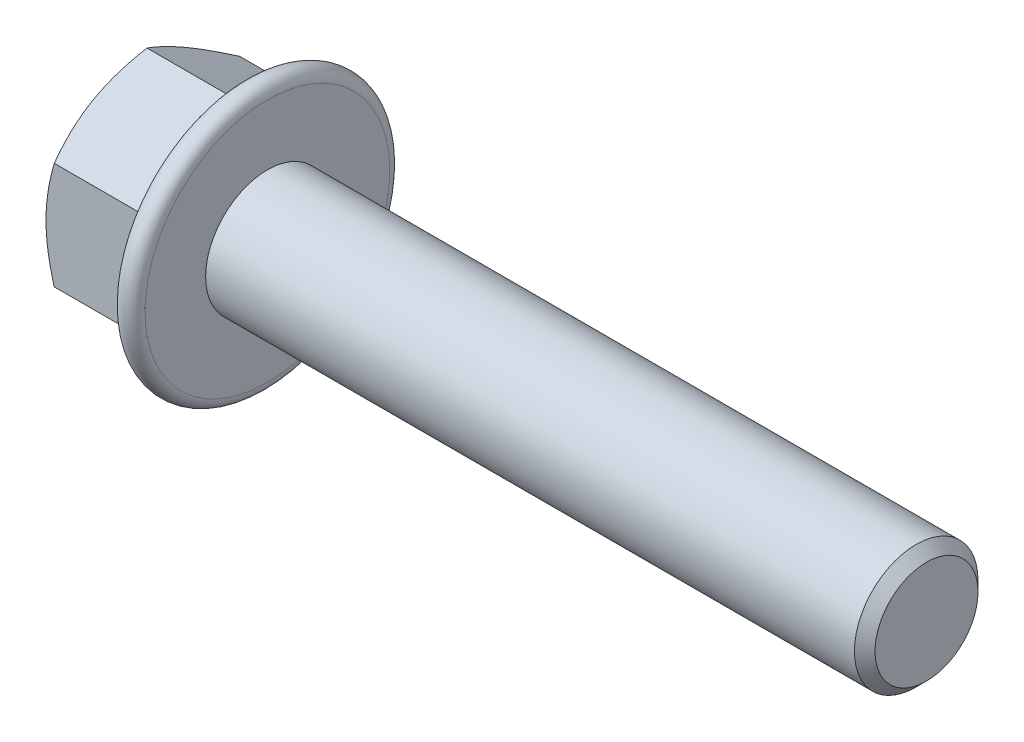
from build123d import *

# Parameters (mm, degrees)
SKETCH2_R           = 4.7625
BOSS_EXTRUDE1_DEPTH = 50.8
CHAMFER1_SIZE       = 0.793750063
BOSS_EXTRUDE2_DEPTH = 9.921875
SKETCH5_OUTSIDE_W   = 70.482
SKETCH5_OUTSIDE_H   = 70.482
SKETCH5_OUTSIDE_R   = 7.14375
CUT_EXTRUDE1_DEPTH  = 9.921875
CUT_EXTRUDE1_DRAFT  = -60
SKETCH6_R           = 6.429375
CUT_EXTRUDE2_DEPTH  = 0.826822917
CUT_EXTRUDE2_DRAFT  = -35
SKETCH14_W          = 25.4
SKETCH14_H          = 4.7625


with BuildPart() as part:
    # Sketch2 → Boss-Extrude1 (new body)
    with BuildSketch(Plane(origin=(0, 0, 0), x_dir=(0, 0, -1), z_dir=(1, 0, 0))):
        Circle(SKETCH2_R)
    extrude(amount=BOSS_EXTRUDE1_DEPTH)

    # Chamfer1
    chamfer1_edges = [part.edges().sort_by_distance(p)[0] for p in [
        (50.8, 0, 4.7625),
    ]]
    chamfer(chamfer1_edges, length=CHAMFER1_SIZE)

    # Sketch3 → Boss-Extrude2 (add)
    with BuildSketch(Plane.ZY):
        Polygon((0, 8.248891971), (-7.14375, 4.124445986), (-7.14375, -4.124445986), (0, -8.248891971), (7.14375, -4.124445986), (7.14375, 4.124445986), align=None)
    extrude(amount=BOSS_EXTRUDE2_DEPTH)

    # Sketch4 → Revolve1 (revolve)
    with BuildSketch(Plane.XY, mode=Mode.PRIVATE) as revolve1_sk:
        with BuildLine():
            Line((0, 0), (0, 9.432563869))
            ThreePointArc((0, 9.432563869), (-0.656824283, 10.28855394), (-1.653645833, 9.875656934))
            Line((-1.653645833, 9.875656934), (-3.230913037, 7.14375))
            Line((-3.230913037, 7.14375), (-3.230913037, 0))
            Line((-3.230913037, 0), (0, 0))
        make_face()
    revolve(revolve1_sk.sketch.rotate(Axis((-3.230913037, 0, 0), (1, 0, 0)), 180), axis=Axis((-3.230913037, 0, 0), (1, 0, 0)))


with BuildPart() as cut_extrude1_tool:
    # Sketch5 outside → Cut-Extrude1 (with draft: the straight prism first)
    with BuildSketch(Plane.ZY.offset(9.921875)):
        Rectangle(SKETCH5_OUTSIDE_W, SKETCH5_OUTSIDE_H)
        Circle(SKETCH5_OUTSIDE_R, mode=Mode.SUBTRACT)
    extrude(amount=-CUT_EXTRUDE1_DEPTH)
    # Cut-Extrude1: the draft: its side faces are tilted about the plane it starts from
    cut_extrude1_sides = [cut_extrude1_tool.faces().sort_by_distance(p)[0] for p in [
        (-4.9609375, -35.241, 0),
        (-4.9609375, 0, 35.241),
        (-4.9609375, 35.241, 0),
        (-4.9609375, 0, -35.241),
        (-4.9609375, 0, -7.14375),
    ]]
    draft(cut_extrude1_sides, Plane.ZY.offset(9.921875), CUT_EXTRUDE1_DRAFT)


with BuildPart() as part_1:
    add(part.part)

    # Cut-Extrude1: cut by cut_extrude1_tool
    add(cut_extrude1_tool.part, mode=Mode.SUBTRACT)


with BuildPart() as cut_extrude2_tool:
    # Sketch6 → Cut-Extrude2 (with draft: the straight prism first)
    with BuildSketch(Plane.ZY.offset(9.921875)):
        Circle(SKETCH6_R)
    extrude(amount=-CUT_EXTRUDE2_DEPTH)
    # Cut-Extrude2: the draft: its side faces are tilted about the plane it starts from
    cut_extrude2_sides = [cut_extrude2_tool.faces().sort_by_distance(p)[0] for p in [
        (-9.508463542, 0, -6.429375),
    ]]
    draft(cut_extrude2_sides, Plane.ZY.offset(9.921875), CUT_EXTRUDE2_DRAFT)


with BuildPart() as part_2:
    add(part_1.part)

    # Cut-Extrude2: cut by cut_extrude2_tool
    add(cut_extrude2_tool.part, mode=Mode.SUBTRACT)

    # Sketch14 → Revolve2 (revolve)
    with BuildSketch(Plane.XY, mode=Mode.PRIVATE) as revolve2_sk:
        with Locations((12.7, 2.38125)):
            Rectangle(SKETCH14_W, SKETCH14_H)
    revolve(revolve2_sk.sketch.rotate(Axis((0, 0, 0), (1, 0, 0)), 90), axis=Axis((0, 0, 0), (1, 0, 0)))


solid = part_2.part
